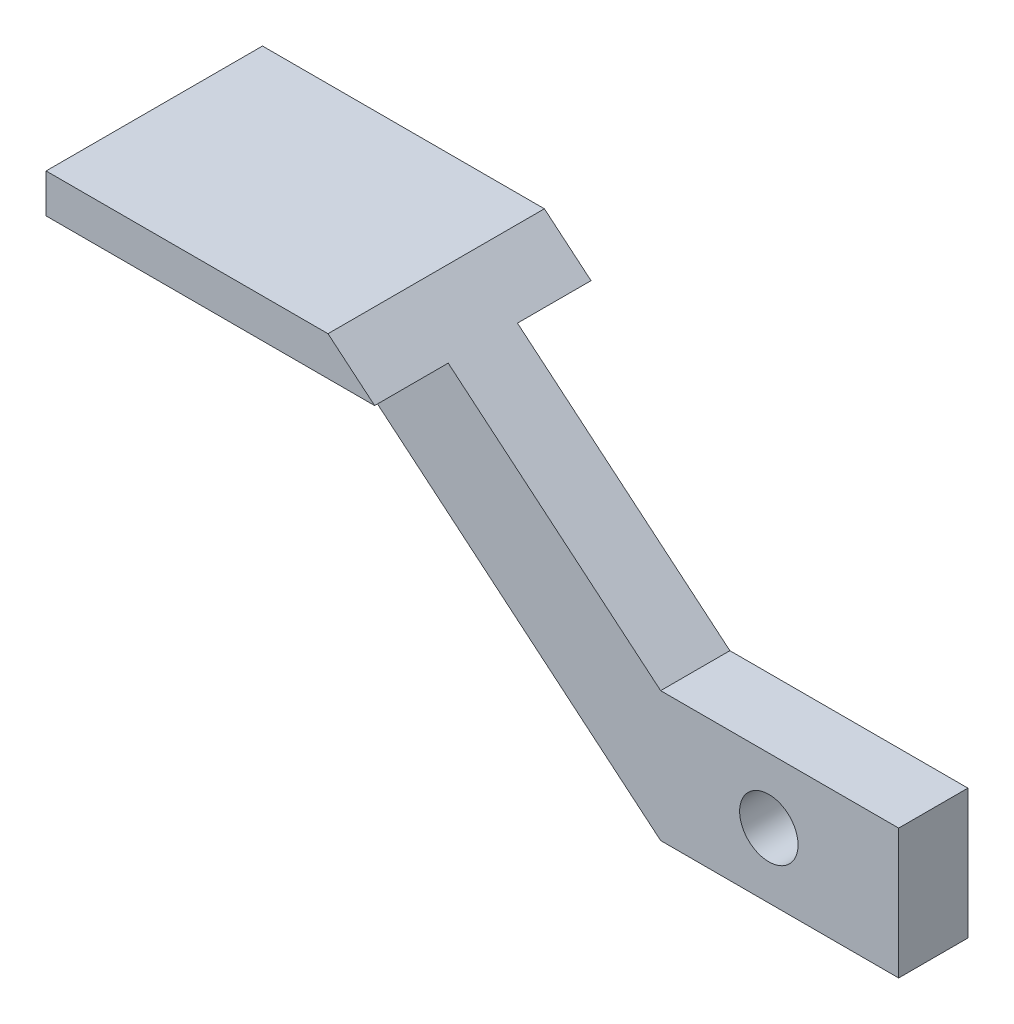
from build123d import *

# Parameters (mm, degrees)
SZKIC1_W                    = 55
SZKIC1_H                    = 30
SZKIC1_R                    = 6.75
DODANIE_WYCI_GNI_CIE1_DEPTH = 8
DODANIE_WYCI_GNI_CIE2_DEPTH = 25


with BuildPart() as part:
    # Szkic1 → Dodanie-wyciągnięcie1 (new, symmetric)
    # profile 1 of 2: a face of its own
    with BuildSketch(Plane.XY):
        with Locations((-27.5, -15)):
            Rectangle(SZKIC1_W, SZKIC1_H)
        with Locations((-30, -15)):
            Circle(SZKIC1_R, mode=Mode.SUBTRACT)
    # profile 2 of 2: a face of its own
    with BuildSketch(Plane.XY):
        Polygon((-114.85915493, 50), (-55, 0), (-55, -30), (-140, 41), (-180, 41), (-180, 50), align=None)
    extrude(amount=DODANIE_WYCI_GNI_CIE1_DEPTH, both=True)

    # Szkic2 → Dodanie-wyciągnięcie2 (add, symmetric)
    with BuildSketch(Plane.XY):
        Polygon((-180, 41), (-140, 41), (-104.084507042, 41), (-114.85915493, 50), (-180, 50), align=None)
    extrude(amount=DODANIE_WYCI_GNI_CIE2_DEPTH, both=True)


solid = part.part
